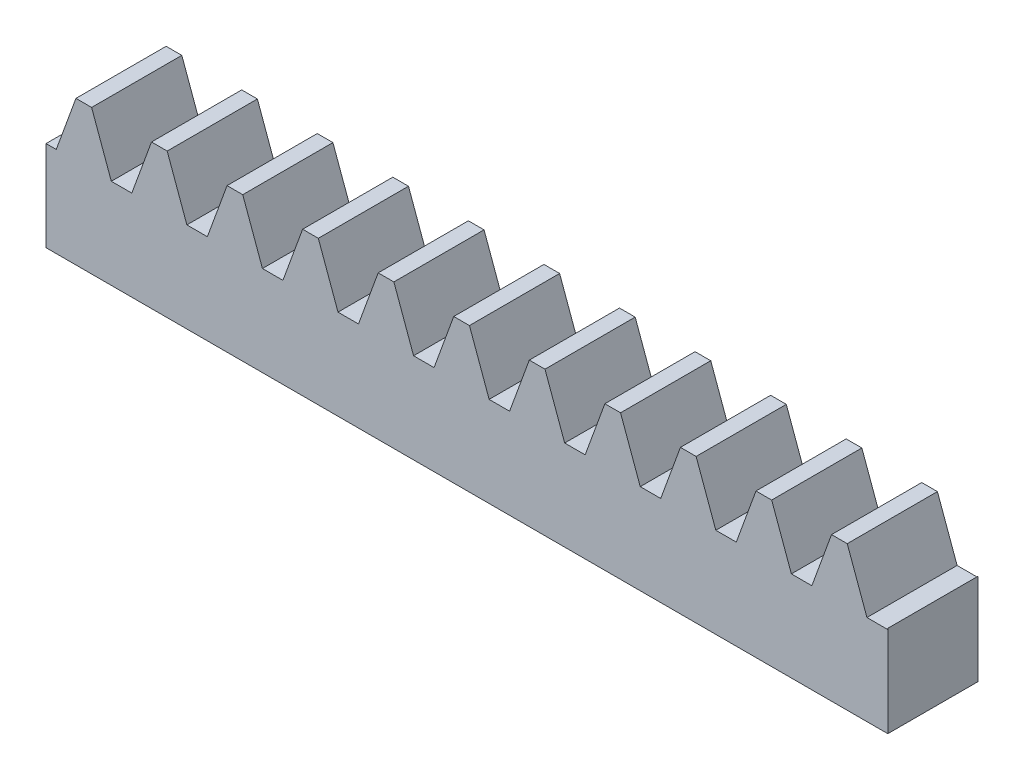
from build123d import *

# Parameters (mm, degrees)
BLANKSKE_W        = 140
BLANKSKE_H        = 24
BLANK_DEPTH       = 15
TOOTHCUTSIM_DEPTH = 143.832069228
TEETHCUTS_COUNT   = 12
TEETHCUTS_PITCH   = 12.5663706


with BuildPart() as part:
    # BlankSke → Blank (new body)
    with BuildSketch(Plane.XY):
        with Locations((70, 12)):
            Rectangle(BLANKSKE_W, BLANKSKE_H)
    extrude(amount=-BLANK_DEPTH)

    # TooCutSkeSim → ToothCutSim (cut, through all)
    with BuildSketch(Plane.XY):
        Polygon((1.702741479, 15), (-1.702741479, 15), (-4.987718431, 24.0254), (4.987718431, 24.0254), align=None)
    toothcutsim = extrude(amount=-TOOTHCUTSIM_DEPTH, mode=Mode.SUBTRACT)

    # TeethCuts: ToothCutSim ×12
    with Locations(*[(i * TEETHCUTS_PITCH, 0, 0) for i in range(1, TEETHCUTS_COUNT)]):
        add(toothcutsim, mode=Mode.SUBTRACT)


solid = part.part
